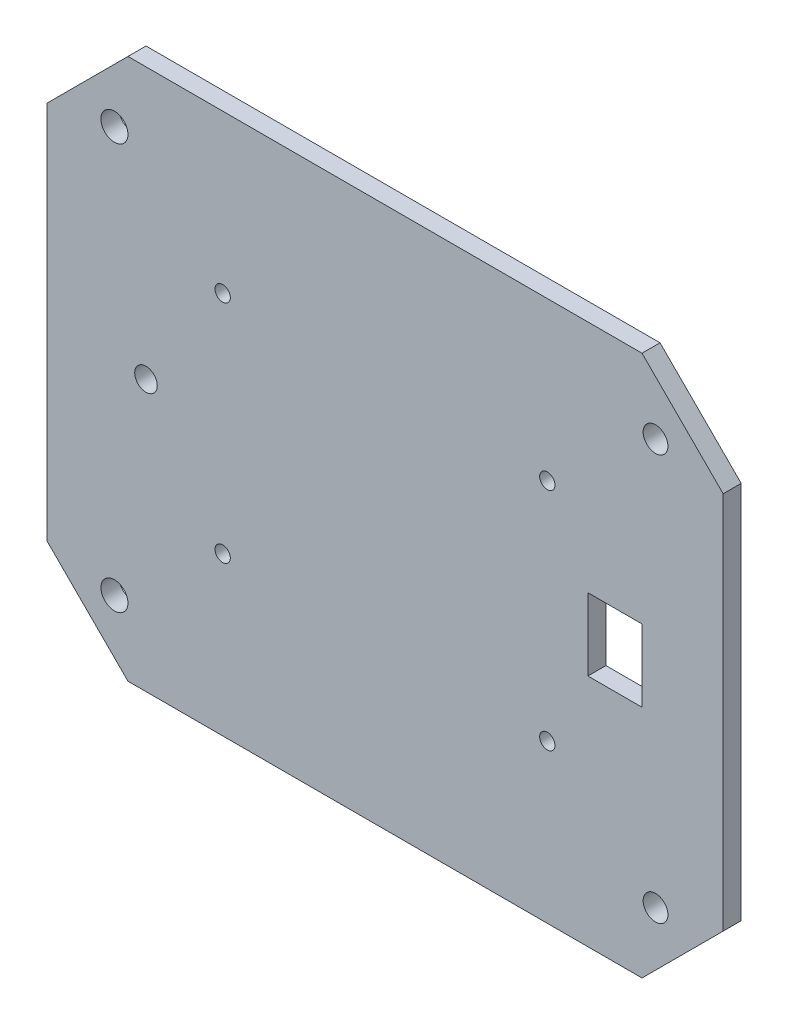
from build123d import *

# Parameters (mm, degrees)
SKETCH_1_R            = 3
SKETCH_1_R_2          = 2.75
SKETCH_1_R_3          = 1.7
SKETCH_1_R_4          = 2.5
SKETCH_1_W            = 12
SKETCH_1_H            = 16
F_01_CEILING_M5_DEPTH = 4


with BuildPart() as part:
    # Эскиз1 → 01_Ceiling_M5 (new body)
    with BuildSketch(Plane.XY):
        Polygon((-57, -60), (57, -60), (75, -42), (75, 42), (57, 60), (-57, 60), (-75, 42), (-75, -42), align=None)
        with Locations((-60, -45)):
            Circle(SKETCH_1_R, mode=Mode.SUBTRACT)
        with Locations((-60, 45)):
            Circle(SKETCH_1_R, mode=Mode.SUBTRACT)
        with Locations((60, -45)):
            Circle(SKETCH_1_R_2, mode=Mode.SUBTRACT)
        with Locations((60, 45)):
            Circle(SKETCH_1_R_2, mode=Mode.SUBTRACT)
        with Locations((-36, -25)):
            Circle(SKETCH_1_R_3, mode=Mode.SUBTRACT)
        with Locations((-36, 25)):
            Circle(SKETCH_1_R_3, mode=Mode.SUBTRACT)
        with Locations((36, -25)):
            Circle(SKETCH_1_R_3, mode=Mode.SUBTRACT)
        with Locations((36, 25)):
            Circle(SKETCH_1_R_3, mode=Mode.SUBTRACT)
        with Locations((-53, 0)):
            Circle(SKETCH_1_R_4, mode=Mode.SUBTRACT)
        with Locations((51, 0)):
            Rectangle(SKETCH_1_W, SKETCH_1_H, mode=Mode.SUBTRACT)
    extrude(amount=F_01_CEILING_M5_DEPTH)


solid = part.part
